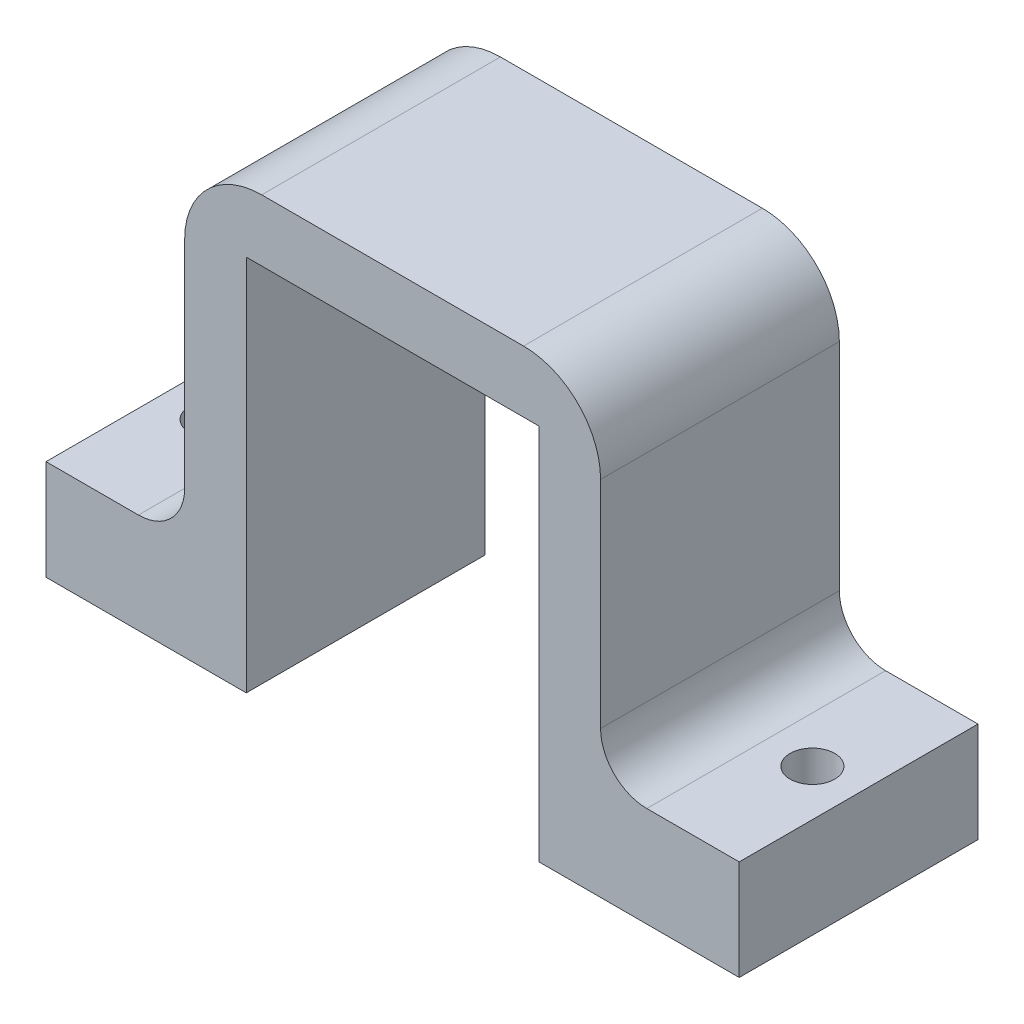
from build123d import *

# Parameters (mm, degrees)
BOSS_EXTRUDE1_DEPTH     = 23
CUT_EXTRUDE2_DEPTH      = 23
CUT_EXTRUDE2_DEPTH_BACK = 10
SKETCH4_W               = 3.5
SKETCH4_H               = 21
SKETCH5_W               = 45
SKETCH5_H               = 7.5
CUT_EXTRUDE3_DEPTH      = 26
SKETCH7_R               = 1.45
CUT_EXTRUDE4_DEPTH      = 50
SKETCH8_W               = 13
SKETCH8_H               = 15.5
BOSS_EXTRUDE2_DEPTH     = 2.5
SKETCH9_R               = 1.45
CUT_EXTRUDE5_DEPTH      = 10


with BuildPart() as part:
    # Sketch1 → Boss-Extrude1 (new body)
    with BuildSketch(Plane.XY):
        with BuildLine():
            Line((0, 3), (0, 17))
            ThreePointArc((0, 17), (1.464466094, 20.535533906), (5, 22))
            Line((5, 22), (22, 22))
            ThreePointArc((22, 22), (25.535533906, 20.535533906), (27, 17))
            Line((27, 17), (27, 3))
            ThreePointArc((27, 3), (27.878679656, 0.878679656), (30, 0))
            Line((30, 0), (36, 0))
            Line((36, 0), (36, -4))
            Line((36, -4), (23, -4))
            Line((23, -4), (23, 18))
            Line((23, 18), (4, 18))
            Line((4, 18), (4, -4))
            Line((4, -4), (-9, -4))
            Line((-9, -4), (-9, 0))
            Line((-9, 0), (-3, 0))
            ThreePointArc((-3, 0), (-0.878679656, 0.878679656), (0, 3))
        make_face()
    extrude(amount=BOSS_EXTRUDE1_DEPTH)

    # Sketch4 → Cut-Extrude2 (cut, two sides: drawn at the far end of the back side and taken through both)
    with BuildSketch(Plane.ZY.offset(-CUT_EXTRUDE2_DEPTH_BACK)):
        with Locations((5.75, 6.5)):
            Rectangle(SKETCH4_W, SKETCH4_H)
    extrude(amount=CUT_EXTRUDE2_DEPTH + CUT_EXTRUDE2_DEPTH_BACK, mode=Mode.SUBTRACT)

    # Sketch5 → Cut-Extrude3 (cut)
    with BuildSketch(Plane(origin=(0, 22, 0), x_dir=(1, 0, 0), z_dir=(0, 1, 0))):
        with Locations((13.5, -3.75)):
            Rectangle(SKETCH5_W, SKETCH5_H)
    extrude(amount=-CUT_EXTRUDE3_DEPTH, mode=Mode.SUBTRACT)

    # Sketch7 → Cut-Extrude4 (cut)
    with BuildSketch(Plane(origin=(0, 0, 0), x_dir=(1, 0, 0), z_dir=(0, 1, 0))):
        with Locations(Location((-6, -15.25, 0), (0, 0, 270))):
            Circle(SKETCH7_R)
        with Locations(Location((33, -15.25, 0), (0, 0, 180))):
            Circle(SKETCH7_R)
    extrude(amount=-CUT_EXTRUDE4_DEPTH, mode=Mode.SUBTRACT)

    # Sketch8 → Boss-Extrude2 (add)
    with BuildSketch(Plane.XZ.offset(4)):
        with Locations((29.5, 15.25)):
            Rectangle(SKETCH8_W, SKETCH8_H)
        with Locations((-2.5, 15.25)):
            Rectangle(SKETCH8_W, SKETCH8_H)
    extrude(amount=BOSS_EXTRUDE2_DEPTH)

    # Sketch9 → Cut-Extrude5 (cut)
    with BuildSketch(Plane(origin=(0, -4, 0), x_dir=(1, 0, 0), z_dir=(0, 1, 0))):
        with Locations((33, -15.25)):
            Circle(SKETCH9_R)
        with Locations(Location((-6, -15.25, 0), (0, 0, 270))):
            Circle(SKETCH9_R)
    extrude(amount=-CUT_EXTRUDE5_DEPTH, mode=Mode.SUBTRACT)


solid = part.part
